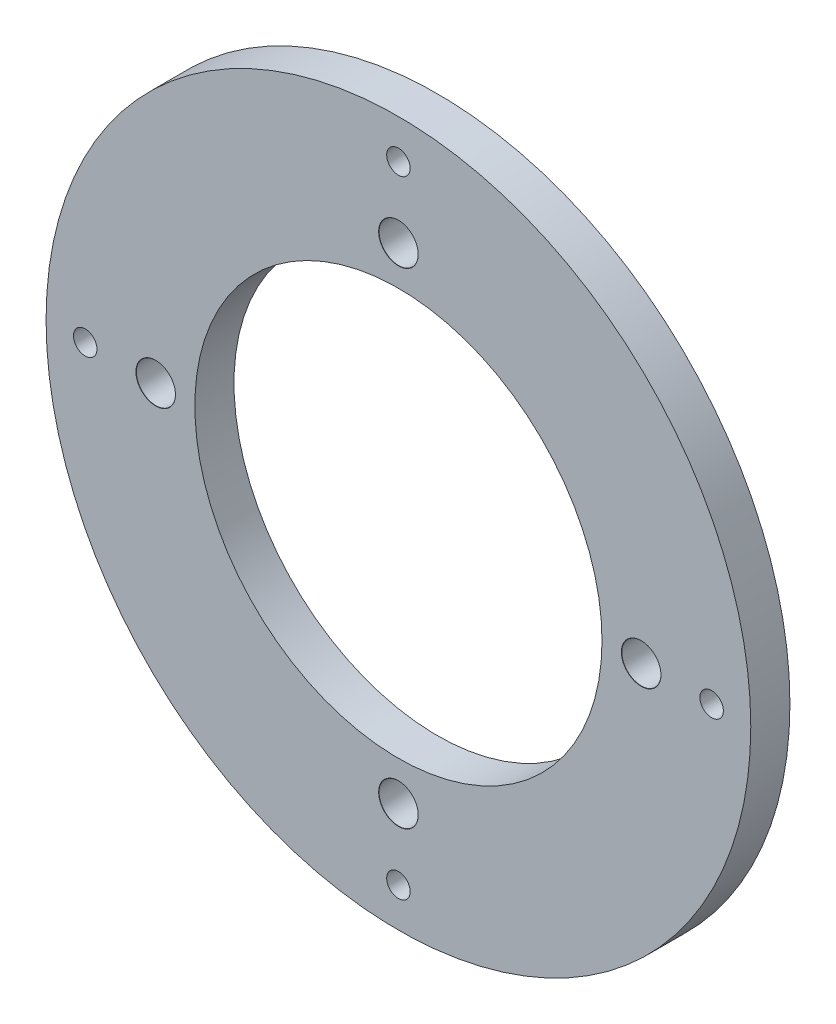
from build123d import *

# Parameters (mm, degrees)
SKETCH1_R                       = 45
SKETCH1_R_2                     = 26
BOSS_EXTRUDE1_DEPTH             = 5
F_5_0MM_DOWEL_HOLE1_D           = 5
F_5_0MM_DOWEL_HOLE1_CSINK_D     = 5.05
F_5_0MM_DOWEL_HOLE1_CSINK_ANGLE = 90
F_3_0MM_DOWEL_HOLE3_D           = 3
F_3_0MM_DOWEL_HOLE3_CSINK_D     = 3.05
F_3_0MM_DOWEL_HOLE3_CSINK_ANGLE = 90


with BuildPart() as part:
    # Sketch1 → Boss-Extrude1 (new body)
    with BuildSketch(Plane.XY):
        Circle(SKETCH1_R)
        Circle(SKETCH1_R_2, mode=Mode.SUBTRACT)
    extrude(amount=BOSS_EXTRUDE1_DEPTH)

    # Ø5.0mm Dowel Hole1 (through all)
    with Locations(Plane.XY.offset(5)):
        with Locations((0, 31), (-31, 0), (0, -31), (31, 0)):
            CounterSinkHole(F_5_0MM_DOWEL_HOLE1_D / 2, F_5_0MM_DOWEL_HOLE1_CSINK_D / 2, counter_sink_angle=F_5_0MM_DOWEL_HOLE1_CSINK_ANGLE)

    # Ø3.0mm Dowel Hole3 (through all)
    with Locations(Plane(origin=(0, 0, 0), x_dir=(-1, 0, 0), z_dir=(0, 0, -1))):
        with Locations((0, 40), (40, 0), (0, -40), (-40, 0)):
            CounterSinkHole(F_3_0MM_DOWEL_HOLE3_D / 2, F_3_0MM_DOWEL_HOLE3_CSINK_D / 2, counter_sink_angle=F_3_0MM_DOWEL_HOLE3_CSINK_ANGLE)


solid = part.part
